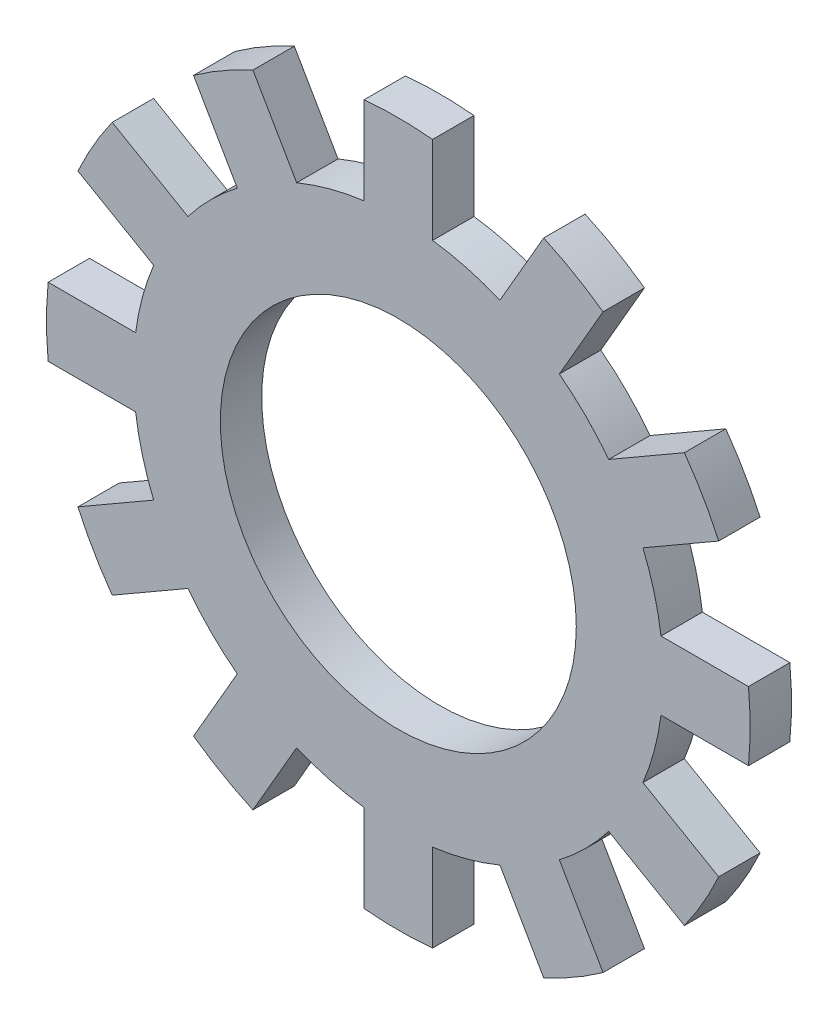
from build123d import *

# Parameters (mm, degrees)
SKETCH1_R         = 3.2
SKETCH1_R_2       = 2.15
EXTRUDE1_DEPTH    = 0.5
EXTRUDE2_DEPTH    = 0.5
CIRPATTERN1_COUNT = 12


with BuildPart() as part:
    # Sketch1 → Extrude1 (new body)
    with BuildSketch(Plane.XY):
        Circle(SKETCH1_R)
        Circle(SKETCH1_R_2, mode=Mode.SUBTRACT)
    extrude(amount=EXTRUDE1_DEPTH)

    # Sketch2 → Extrude2 (add)
    with BuildSketch(Plane.XY):
        with BuildLine():
            Line((-0.414110472, 4.229776887), (-0.414110472, 3.173091949))
            Line((-0.414110472, 3.173091949), (0.414110472, 3.173091949))
            Line((0.414110472, 3.173091949), (0.414110472, 4.229776887))
            ThreePointArc((0.414110472, 4.229776887), (0, 4.25), (-0.414110472, 4.229776887))
        make_face()
    extrude2 = extrude(amount=EXTRUDE2_DEPTH)

    # CirPattern1: Extrude2 ×12 about axis
    cirpattern1_axis = Axis((0, 0, 0), (0, 0, 1))
    for i in range(1, CIRPATTERN1_COUNT):
        add(extrude2.rotate(cirpattern1_axis, i * 360 / CIRPATTERN1_COUNT))


solid = part.part
